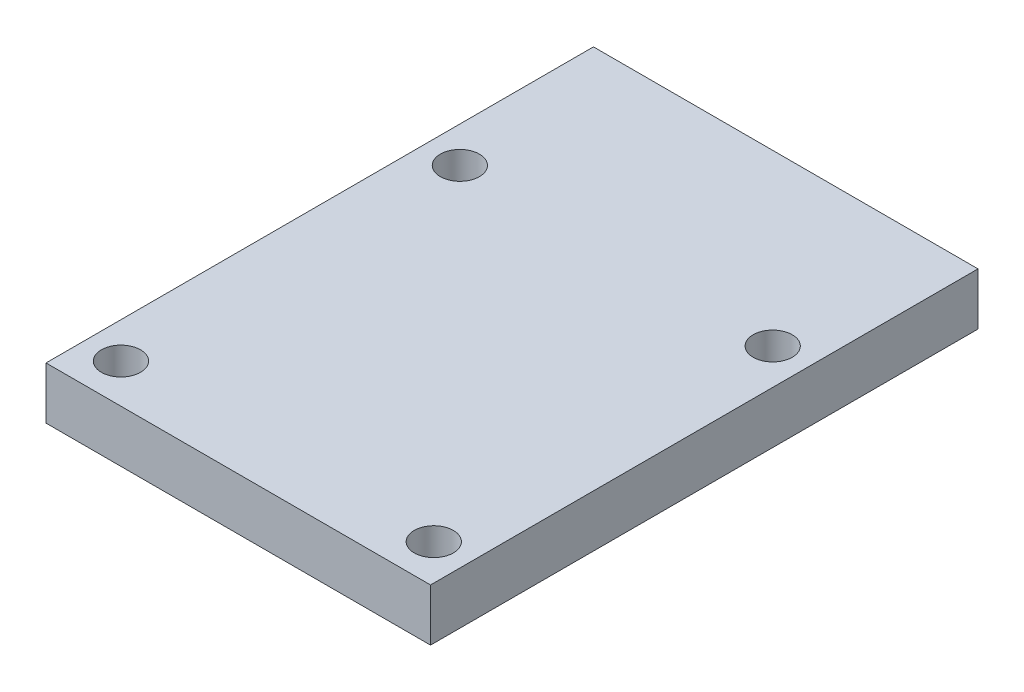
from build123d import *

# Parameters (mm, degrees)
SKETCH_1_W      = 29.5
SKETCH_1_H      = 42
SKETCH_1_R      = 1.5
EXTRUDE_1_DEPTH = 4


with BuildPart() as part:
    # 草图1 → 凸台-拉伸1 (new body)
    with BuildSketch(Plane(origin=(0, 0, 0), x_dir=(1, 0, 0), z_dir=(0, 1, 0))):
        Rectangle(SKETCH_1_W, SKETCH_1_H)
        with Locations(Location((12, 8, 0), (0, 0, 270))):
            Circle(SKETCH_1_R, mode=Mode.SUBTRACT)
        with Locations(Location((12, -18, 0), (0, 0, 90))):
            Circle(SKETCH_1_R, mode=Mode.SUBTRACT)
        with Locations(Location((-12, -18, 0), (0, 0, 270))):
            Circle(SKETCH_1_R, mode=Mode.SUBTRACT)
        with Locations(Location((-12, 8, 0), (0, 0, 90))):
            Circle(SKETCH_1_R, mode=Mode.SUBTRACT)
    extrude(amount=EXTRUDE_1_DEPTH)


solid = part.part
